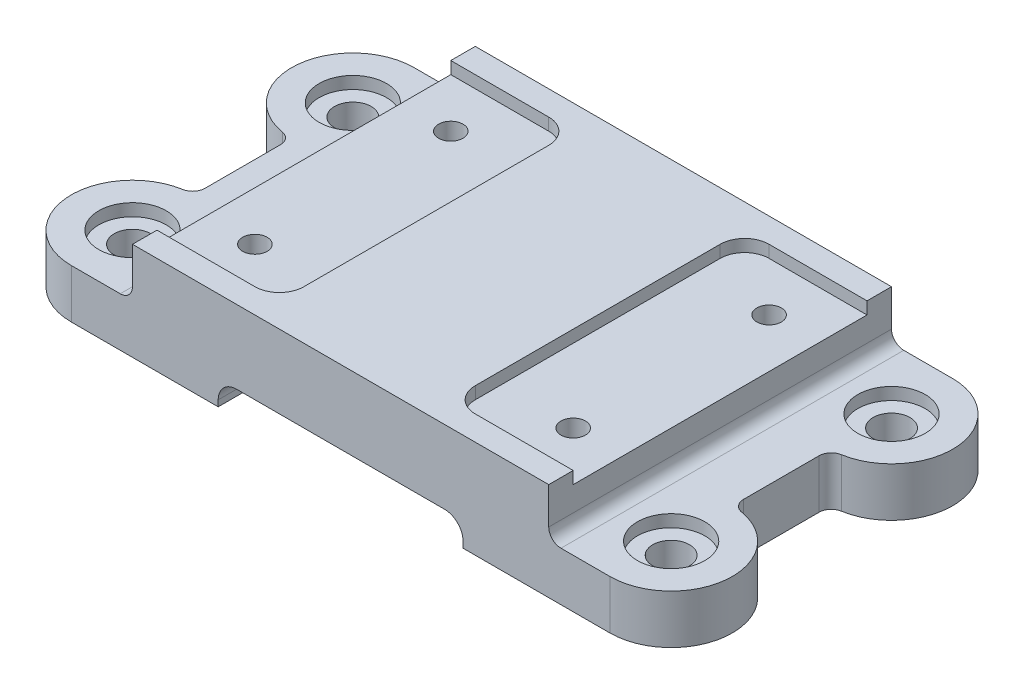
from build123d import *

# Parameters (mm, degrees)
EXTRUDE1_DEPTH                                       = 88.9
EXTRUDE2_DEPTH                                       = 12.7
EXTRUDE3_DEPTH                                       = 3.175
CBORE_FOR_1_4_BINDING_HEAD_MACHINE_SCREW_D           = 9.525
CBORE_FOR_1_4_BINDING_HEAD_MACHINE_SCREW_CBORE_D     = 17.4752
CBORE_FOR_1_4_BINDING_HEAD_MACHINE_SCREW_CBORE_DEPTH = 3.175
F_1_4_20_TAPPED_HOLE1_AT_2_COUNT                     = 2
F_1_4_20_TAPPED_HOLE1_AT_2_PITCH                     = 50.8
FILLET2_R                                            = 3.175
FILLET2_OF_MIRROR1_R                                 = 3.175


with BuildPart() as part:
    # Sketch1 → Extrude1 (new body)
    with BuildSketch(Plane.XY):
        with BuildLine():
            Line((69.85, 25.4), (123.825, 25.4))
            Line((123.825, 25.4), (123.825, 15.875))
            ThreePointArc((123.825, 15.875), (124.75493597, 13.62993597), (127, 12.7))
            Line((127, 12.7), (139.7, 12.7))
            Line((139.7, 12.7), (139.7, 0))
            Line((139.7, 0), (101.6, 0))
            Line((101.6, 0), (101.6, 1.5748))
            ThreePointArc((101.6, 1.5748), (100.201376302, 4.951376302), (96.8248, 6.35))
            Line((96.8248, 6.35), (69.85, 6.35))
            Line((69.85, 6.35), (69.85, 25.4))
        make_face()
    extrude1 = extrude(amount=-EXTRUDE1_DEPTH)

    # Sketch2 → Extrude2 (add)
    with BuildSketch(Plane(origin=(0, 0, 0), x_dir=(1, 0, 0), z_dir=(0, 1, 0))):
        with BuildLine():
            Line((139.7, 57.15), (139.7, 88.9))
            ThreePointArc((139.7, 88.9), (155.575, 73.025), (139.7, 57.15))
        make_face()
        with BuildLine():
            Line((139.7, 31.75), (139.7, 0))
            ThreePointArc((139.7, 0), (155.575, 15.875), (139.7, 31.75))
        make_face()
    extrude2 = extrude(amount=EXTRUDE2_DEPTH)

    # Sketch3 → Extrude3 (cut)
    with BuildSketch(Plane(origin=(123.825, 25.4, 0), x_dir=(-1, 0, 0), z_dir=(0, 1, 0))):
        with BuildLine():
            Line((0, -82.55), (25.4, -82.55))
            ThreePointArc((25.4, -82.55), (29.890128061, -80.690128061), (31.75, -76.2))
            Line((31.75, -76.2), (31.75, -12.7))
            ThreePointArc((31.75, -12.7), (29.890128061, -8.209871939), (25.4, -6.35))
            Line((25.4, -6.35), (0, -6.35))
            Line((0, -6.35), (0, -82.55))
        make_face()
    extrude3 = extrude(amount=-EXTRUDE3_DEPTH, mode=Mode.SUBTRACT)

    # CBORE for 1/4 Binding Head Machine Screw1 (through all)
    with Locations(Plane(origin=(139.7, 12.7, -73.025), x_dir=(0, 0, 1), z_dir=(0, 1, 0))):
        with Locations((0, 0), (57.15, 0)):
            cbore_for_1_4_binding_head_machine_screw = CounterBoreHole(CBORE_FOR_1_4_BINDING_HEAD_MACHINE_SCREW_D / 2, CBORE_FOR_1_4_BINDING_HEAD_MACHINE_SCREW_CBORE_D / 2, CBORE_FOR_1_4_BINDING_HEAD_MACHINE_SCREW_CBORE_DEPTH)

    # Sketch5 → 1/4-20 Tapped Hole1 (revolve, cut)
    with BuildSketch(Plane(origin=(111.125, 22.225, -19.05), x_dir=(0, 0, 1), z_dir=(1, 0, 0))):
        Polygon((0, 0), (0, 17.535816902), (2.5527, 16.002), (2.5527, 12.7), (3.175, 12.7), (3.175, 0), align=None)
    f_1_4_20_tapped_hole1 = revolve(axis=Axis((111.125, 28.575, -19.05), (0, -1, 0)), mode=Mode.SUBTRACT)

    # 1/4-20 Tapped Hole1 at 2: 1/4-20 Tapped Hole1 ×2
    with Locations(*[(0, 0, -i * F_1_4_20_TAPPED_HOLE1_AT_2_PITCH) for i in range(1, F_1_4_20_TAPPED_HOLE1_AT_2_COUNT)]):
        add(f_1_4_20_tapped_hole1, mode=Mode.SUBTRACT)

    # Fillet2
    fillet2_edges = [part.edges().sort_by_distance(p)[0] for p in [
        (139.7, 6.35, -57.15),
        (139.7, 6.35, -31.75),
    ]]
    fillet(fillet2_edges, radius=FILLET2_R)

    # Mirror1: Extrude1, Extrude2, Extrude3, CBORE for 1/4 Binding Head Machine Screw1, 1/4-20 Tapped Hole1 across plane
    add(extrude1.mirror(Plane(origin=(69.85, 25.4, -88.9), x_dir=(0, 0, 1), z_dir=(-1, 0, 0))))
    add(extrude2.mirror(Plane(origin=(69.85, 25.4, -88.9), x_dir=(0, 0, 1), z_dir=(-1, 0, 0))))
    add(extrude3.mirror(Plane(origin=(69.85, 25.4, -88.9), x_dir=(0, 0, 1), z_dir=(-1, 0, 0))), mode=Mode.SUBTRACT)
    add(cbore_for_1_4_binding_head_machine_screw.mirror(Plane(origin=(69.85, 25.4, -88.9), x_dir=(0, 0, 1), z_dir=(-1, 0, 0))), mode=Mode.SUBTRACT)
    add(f_1_4_20_tapped_hole1.mirror(Plane(origin=(69.85, 25.4, -88.9), x_dir=(0, 0, 1), z_dir=(-1, 0, 0))), mode=Mode.SUBTRACT)

    # Mirror1 copy 1 sketch → Mirror1 copy 1 (revolve, cut)
    with BuildSketch(Plane(origin=(28.575, 22.225, -69.85), x_dir=(0, 0, 1), z_dir=(-1, 0, 0))):
        Polygon((0, 0), (0, -17.535816902), (2.5527, -16.002), (2.5527, -12.7), (3.175, -12.7), (3.175, 0), align=None)
    revolve(axis=Axis((28.575, 28.575, -69.85), (0, 1, 0)), mode=Mode.SUBTRACT)

    # Fillet2 of Mirror1
    fillet2_of_mirror1_edges = [part.edges().sort_by_distance(p)[0] for p in [
        (0, 6.35, -57.15),
        (0, 6.35, -31.75),
    ]]
    fillet(fillet2_of_mirror1_edges, radius=FILLET2_OF_MIRROR1_R)


solid = part.part
